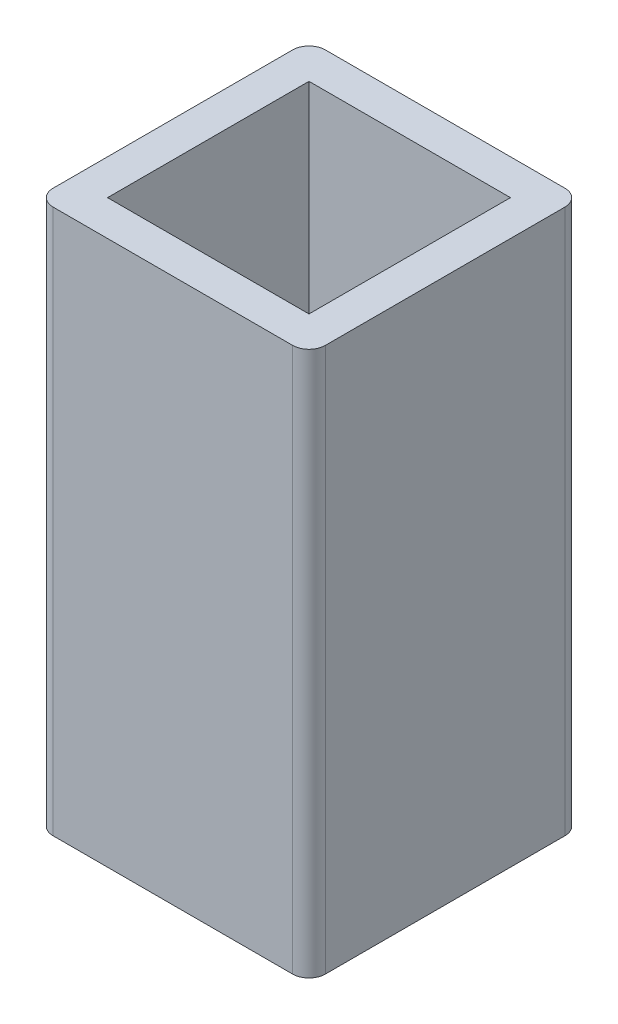
from build123d import *

# Parameters (mm, degrees)
SKETCH1_W           = 9.398
SKETCH1_H           = 9.398
BOSS_EXTRUDE1_DEPTH = 25.4


with BuildPart() as part:
    # Sketch1 → Boss-Extrude1 (new body)
    with BuildSketch(Plane(origin=(0, 0, 0), x_dir=(1, 0, 0), z_dir=(0, 1, 0))):
        with BuildLine():
            Line((-5.588, -6.35), (5.588, -6.35))
            ThreePointArc((5.588, -6.35), (6.126815367, -6.126815367), (6.35, -5.588))
            Line((6.35, -5.588), (6.35, 5.588))
            ThreePointArc((6.35, 5.588), (6.126815367, 6.126815367), (5.588, 6.35))
            Line((5.588, 6.35), (-5.588, 6.35))
            ThreePointArc((-5.588, 6.35), (-6.126815367, 6.126815367), (-6.35, 5.588))
            Line((-6.35, 5.588), (-6.35, -5.588))
            ThreePointArc((-6.35, -5.588), (-6.126815367, -6.126815367), (-5.588, -6.35))
        make_face()
        Rectangle(SKETCH1_W, SKETCH1_H, mode=Mode.SUBTRACT)
    extrude(amount=BOSS_EXTRUDE1_DEPTH)


solid = part.part
